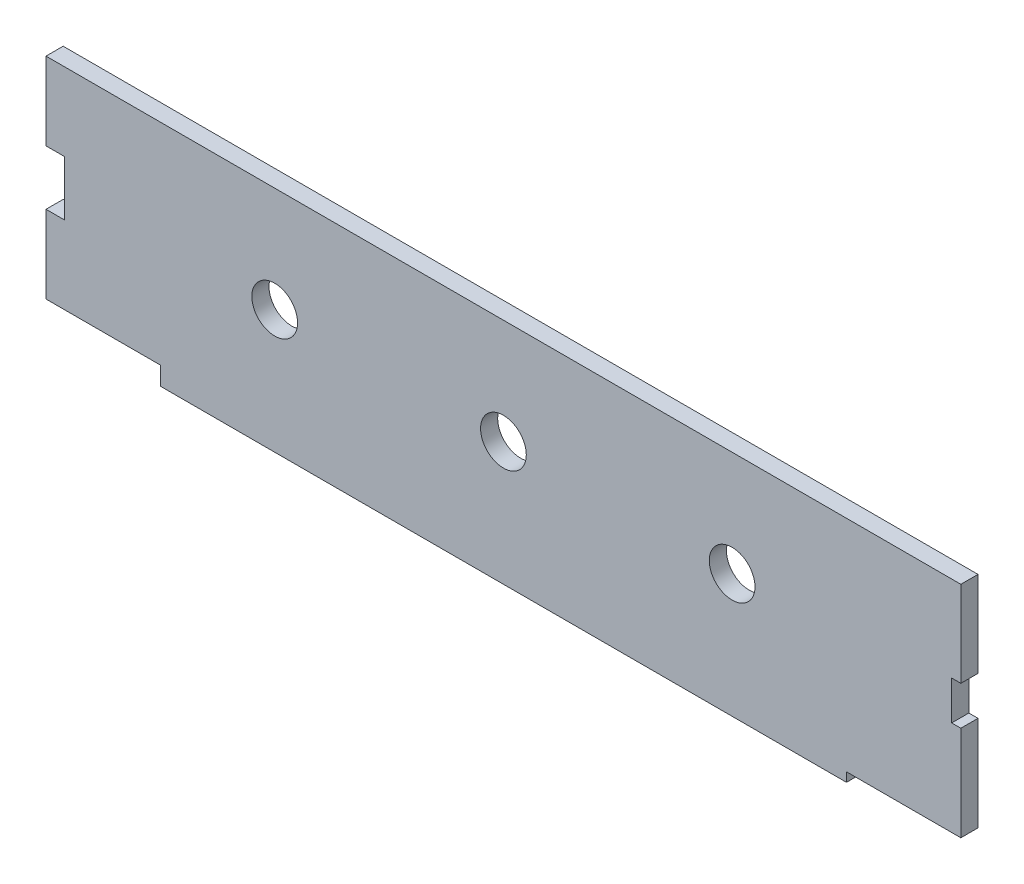
from build123d import *

# Parameters (mm, degrees)
CROQUIS1_R              = 2
SALIENTE_EXTRUIR1_DEPTH = 1.5


with BuildPart() as part:
    # Croquis1 → Saliente-Extruir1 (new body)
    with BuildSketch(Plane.XY):
        Polygon((-40, 9.2), (40, 9.2), (40, 1.7), (39.2, 1.7), (39.2, -1.7), (40, -1.7), (40, -10), (30, -10), (30, -10.8), (-30, -10.8), (-30, -9.2), (-40, -9.2), (-40, -2.4), (-38.4, -2.4), (-38.4, 2.4), (-40, 2.4), align=None)
        with Locations((20, 0)):
            Circle(CROQUIS1_R, mode=Mode.SUBTRACT)
        Circle(CROQUIS1_R, mode=Mode.SUBTRACT)
        with Locations((-20, 0)):
            Circle(CROQUIS1_R, mode=Mode.SUBTRACT)
    extrude(amount=SALIENTE_EXTRUIR1_DEPTH)


solid = part.part
